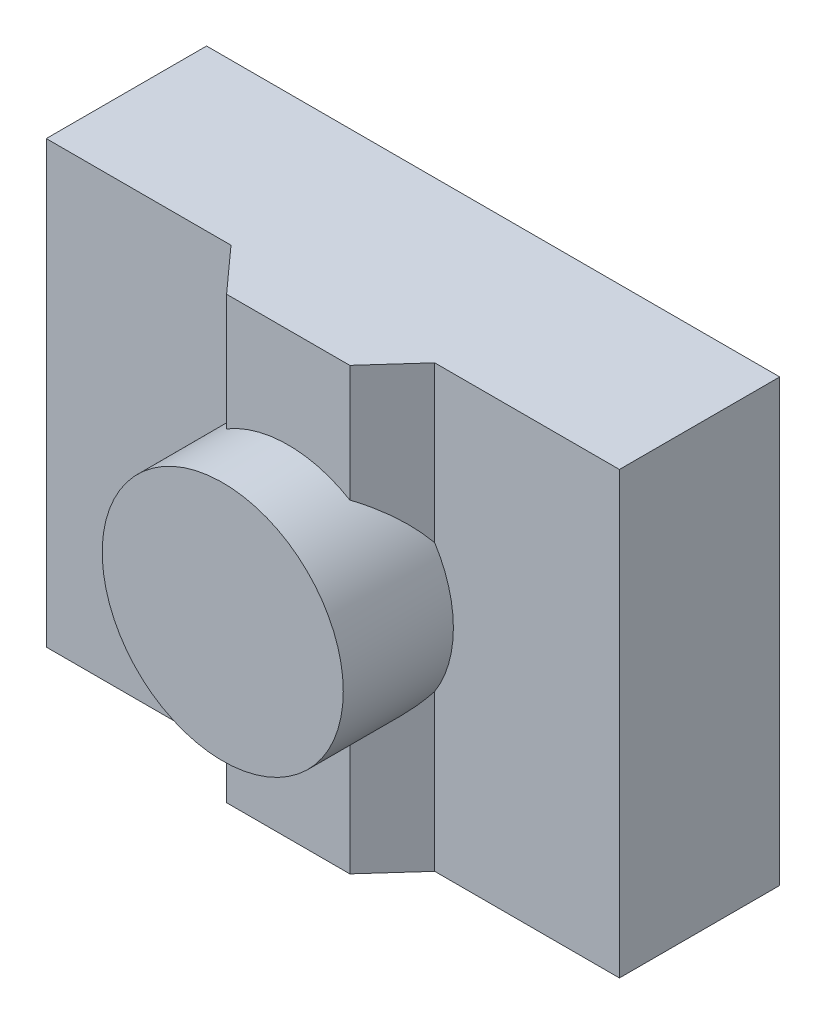
from build123d import *

# Parameters (mm, degrees)
EXTRUDE1_DEPTH = 101.6
EXTRUDE2_REACH = 180.036
SKETCH2_R      = 27.805675623


with BuildPart() as part:
    # Sketch1 → Extrude1 (new body)
    with BuildSketch(Plane(origin=(0, 0, 0), x_dir=(1, 0, 0), z_dir=(0, 1, 0))):
        Polygon((0, 36.981224411), (0, 0), (42.615353822, 0), (51.897733448, -10.30089681), (80.325021053, -10.30089681), (89.607400679, 0), (132.222754501, 0), (132.222754501, 36.981224411), align=None)
    extrude(amount=-EXTRUDE1_DEPTH)

    # Sketch2 → Extrude2 (add, up to next)
    with BuildSketch(Plane.XY.offset(25.4), mode=Mode.PRIVATE) as extrude2_sk1:
        with Locations((66.111377251, -50.8)):
            Circle(SKETCH2_R)
    extrude2_tool1 = extrude(extrude2_sk1.sketch, amount=-EXTRUDE2_REACH, mode=Mode.PRIVATE) - part.part
    add(extrude2_tool1.solids().sort_by_distance((66.111377, -50.8, 25.4))[0])


solid = part.part
